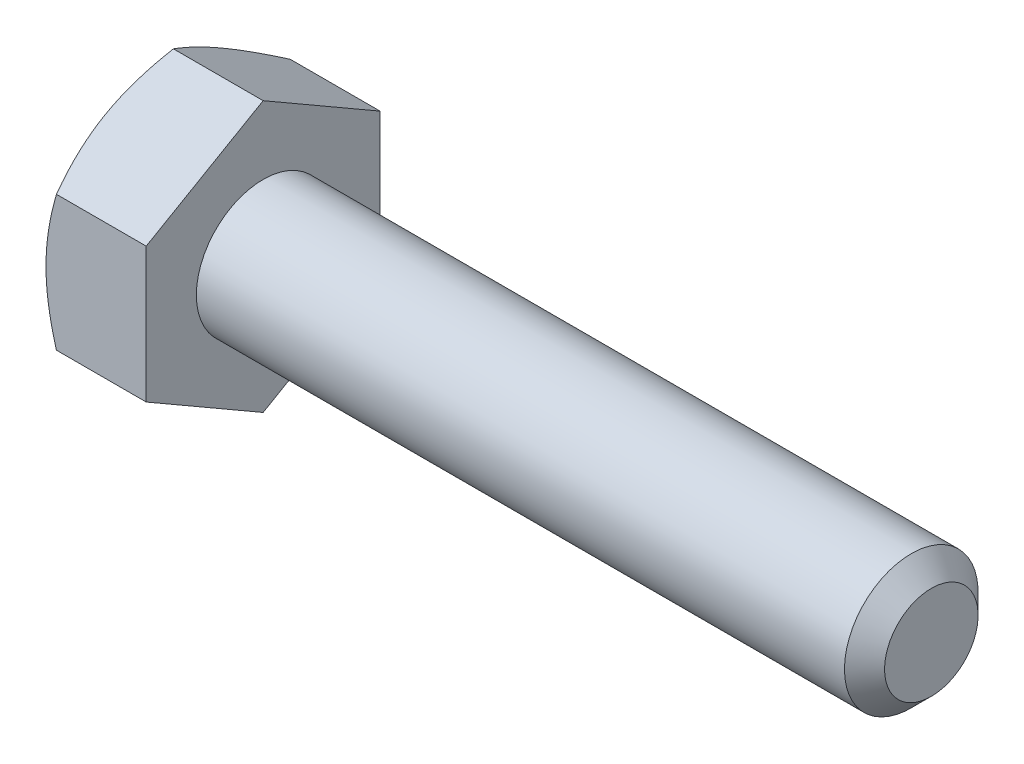
from build123d import *

# Parameters (mm, degrees)
SKETCH5_R           = 3.175
BOSS_EXTRUDE3_DEPTH = 31.75
CHAMFER1_SIZE       = 0.9525
BOSS_EXTRUDE4_DEPTH = 4.7625
SKETCH8_OUTSIDE_W   = 154.484
SKETCH8_OUTSIDE_H   = 156.204
SKETCH8_OUTSIDE_R   = 5.55625
CUT_EXTRUDE3_DEPTH  = 38.485959003
CUT_EXTRUDE3_DRAFT  = -60


with BuildPart() as part:
    # Sketch5 → Boss-Extrude3 (new body)
    with BuildSketch(Plane(origin=(18.25625, 0, 0), x_dir=(0, 0, -1), z_dir=(1, 0, 0))):
        Circle(SKETCH5_R)
    extrude(amount=-BOSS_EXTRUDE3_DEPTH)

    # Chamfer1
    chamfer1_edges = [part.edges().sort_by_distance(p)[0] for p in [
        (18.25625, 0, 3.175),
    ]]
    chamfer(chamfer1_edges, length=CHAMFER1_SIZE)

    # Sketch6 → Boss-Extrude4 (add)
    with BuildSketch(Plane.ZY.offset(13.49375)):
        Polygon((5.55625, 3.207902433), (0, 6.415804866), (-5.55625, 3.207902433), (-5.55625, -3.207902433), (0, -6.415804866), (5.55625, -3.207902433), align=None)
    extrude(amount=BOSS_EXTRUDE4_DEPTH)


with BuildPart() as cut_extrude3_tool:
    # Sketch8 outside → Cut-Extrude3 (with draft: the straight prism first)
    with BuildSketch(Plane.ZY.offset(18.25625)):
        Rectangle(SKETCH8_OUTSIDE_W, SKETCH8_OUTSIDE_H)
        Circle(SKETCH8_OUTSIDE_R, mode=Mode.SUBTRACT)
    extrude(amount=-CUT_EXTRUDE3_DEPTH)
    # Cut-Extrude3: the draft: its side faces are tilted about the plane it starts from
    cut_extrude3_sides = [cut_extrude3_tool.faces().sort_by_distance(p)[0] for p in [
        (0.986729502, -78.102, 0),
        (0.986729502, 0, 77.242),
        (0.986729502, 78.102, 0),
        (0.986729502, 0, -77.242),
        (0.986729502, 0, -5.55625),
    ]]
    draft(cut_extrude3_sides, Plane.ZY.offset(18.25625), CUT_EXTRUDE3_DRAFT)


with BuildPart() as part_1:
    add(part.part)

    # Cut-Extrude3: cut by cut_extrude3_tool
    add(cut_extrude3_tool.part, mode=Mode.SUBTRACT)


solid = part_1.part
